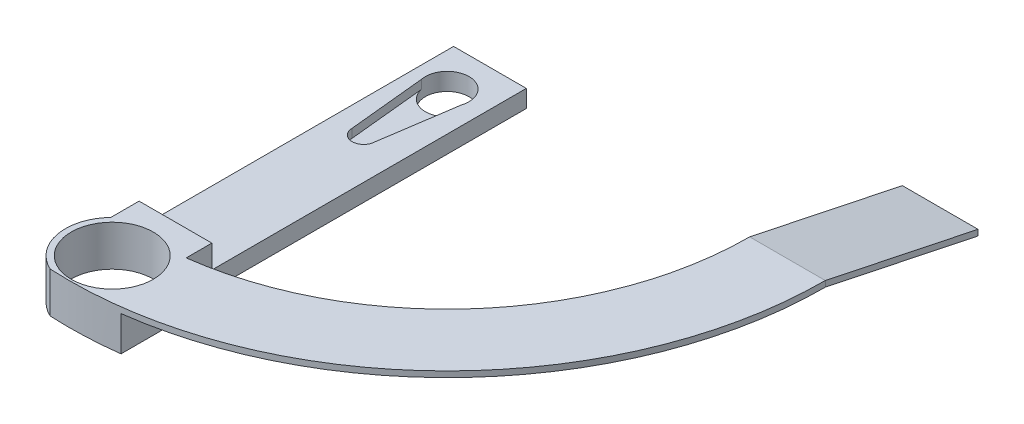
from build123d import *

# Parameters (mm, degrees)
SKETCH1_R                = 7.051488697
BOSS_EXTRUDE1_DEPTH      = 3
SKETCH2_R                = 7.051488697
BOSS_EXTRUDE2_DEPTH      = 4
SKETCH3_R                = 3.75
CUT_EXTRUDE1_DEPTH       = 93.010868923
CUT_EXTRUDE2_START       = -3
CUT_EXTRUDE2_DEPTH       = 1.5
SKETCH5_W                = 67.326740962
SKETCH5_H                = 77.001413362
CUT_EXTRUDE4_DEPTH       = 6
BOSS_EXTRUDE3_DEPTH      = 10
BOSS_EXTRUDE3_DEPTH_BACK = 1
SKETCH6_W                = 13
SKETCH6_H                = 26.261119779
CUT_EXTRUDE5_DEPTH       = 89.770385235


with BuildPart() as part:
    # Sketch1 → Boss-Extrude1 (new body)
    with BuildSketch(Plane(origin=(0, 0, 0), x_dir=(1, 0, 0), z_dir=(0, 1, 0))):
        with BuildLine():
            Line((6.693069307, -1.487522855), (6.693069307, -51.567458957))
            ThreePointArc((6.693069307, -51.567458957), (22.956358252, -46.658392769), (36.769552622, -36.769552622))
            ThreePointArc((36.769552622, -36.769552622), (43.25852742, -28.856538348), (48.072152744, -19.825945893))
            Line((48.072152744, -19.825945893), (60.09019093, -24.782432367))
            ThreePointArc((60.09019093, -24.782432367), (54.073159275, -36.070672935), (45.961940777, -45.961940777))
            ThreePointArc((45.961940777, -45.961940777), (26.581470301, -59.316316783), (3.715889133, -64.893698985))
            ThreePointArc((3.715889133, -64.893698985), (0.18200985, -64.999745172), (-3.352407903, -64.913491365))
            ThreePointArc((-3.352407903, -64.913491365), (-7.908445684, -59.104066137), (-5.814964059, -52.024218933))
            Line((-5.814964059, -52.024218933), (-5.814964059, -3.088434015))
            Line((-5.814964059, -3.088434015), (-5.814964059, 3.911565985))
            Line((-5.814964059, 3.911565985), (-5.814964059, 6.911565985))
            Line((-5.814964059, 6.911565985), (6.693069307, 6.911565985))
            Line((6.693069307, 6.911565985), (6.693069307, 3.911565985))
            Line((6.693069307, 3.911565985), (6.693069307, -1.487522855))
        make_face()
        with Locations(Location((0, -57.593120372, 0), (0, 0, 270))):
            Circle(SKETCH1_R, mode=Mode.SUBTRACT)
    extrude(amount=BOSS_EXTRUDE1_DEPTH)

    # Sketch2 → Boss-Extrude2 (add)
    with BuildSketch(Plane(origin=(0, 3, 0), x_dir=(1, 0, 0), z_dir=(0, 1, 0))):
        with BuildLine():
            Line((-5.814964059, -47.160734717), (6.693069307, -47.160734717))
            Line((6.693069307, -47.160734717), (6.693069307, -51.567458957))
            ThreePointArc((6.693069307, -51.567458957), (31.649459702, -41.259080219), (48.072152744, -19.825945893))
            ThreePointArc((48.072152744, -19.825945893), (51.008587231, -10.105643407), (52, 0))
            Line((52, 0), (65, 0))
            ThreePointArc((65, 0), (63.760734039, -12.632054258), (60.09019093, -24.782432367))
            ThreePointArc((60.09019093, -24.782432367), (34.747942094, -54.932508774), (-3.352407903, -64.913491365))
            ThreePointArc((-3.352407903, -64.913491365), (-7.908445684, -59.104066137), (-5.814964059, -52.024218933))
            Line((-5.814964059, -52.024218933), (-5.814964059, -47.160734717))
        make_face()
        with Locations(Location((0, -57.593120372, 0), (0, 0, 270))):
            Circle(SKETCH2_R, mode=Mode.SUBTRACT)
    extrude(amount=BOSS_EXTRUDE2_DEPTH)

    # Sketch3 → Cut-Extrude1 (cut, through all)
    with BuildSketch(Plane(origin=(0, 3, 0), x_dir=(1, 0, 0), z_dir=(0, 1, 0))):
        with Locations(Location((0, 0, 0), (0, 0, 270))):
            Circle(SKETCH3_R)
    extrude(amount=-CUT_EXTRUDE1_DEPTH, mode=Mode.SUBTRACT)

    # Sketch4 → Cut-Extrude2 (cut)
    with BuildSketch(Plane.XZ.offset(CUT_EXTRUDE2_START)):
        with BuildLine():
            Line((3.75, 0), (1.65, 14))
            ThreePointArc((1.65, 14), (-0.35, 16), (-2.35, 14))
            Line((-2.35, 14), (-3.75, 0))
            ThreePointArc((-3.75, 0), (0, -3.75), (3.75, 0))
        make_face()
    extrude(amount=CUT_EXTRUDE2_DEPTH, mode=Mode.SUBTRACT)

    # Sketch5 → Cut-Extrude4 (cut)
    with BuildSketch(Plane.XZ):
        with Locations((42.047234811, 32.501031374)):
            Rectangle(SKETCH5_W, SKETCH5_H)
    extrude(amount=-CUT_EXTRUDE4_DEPTH, mode=Mode.SUBTRACT)

    # Sketch6 → Boss-Extrude3 (add, two sides: drawn at the far end of the back side and taken through both)
    with BuildSketch(Plane.XZ.offset(-6).offset(-BOSS_EXTRUDE3_DEPTH_BACK)):
        with Locations((58.5, -13.13055989)):
            Rectangle(SKETCH6_W, SKETCH6_H)
    extrude(amount=BOSS_EXTRUDE3_DEPTH + BOSS_EXTRUDE3_DEPTH_BACK)

    # Sketch7 → Cut-Extrude5 (cut, through all)
    with BuildSketch(Plane.ZY.offset(-52)):
        Polygon((0, 7), (-26.261119779, 1.5), (-26.261119779, 7), align=None)
        Polygon((-26.261119779, 0.5), (0, 6), (0, -4), (-26.261119779, -4), align=None)
    extrude(amount=-CUT_EXTRUDE5_DEPTH, mode=Mode.SUBTRACT)


solid = part.part
